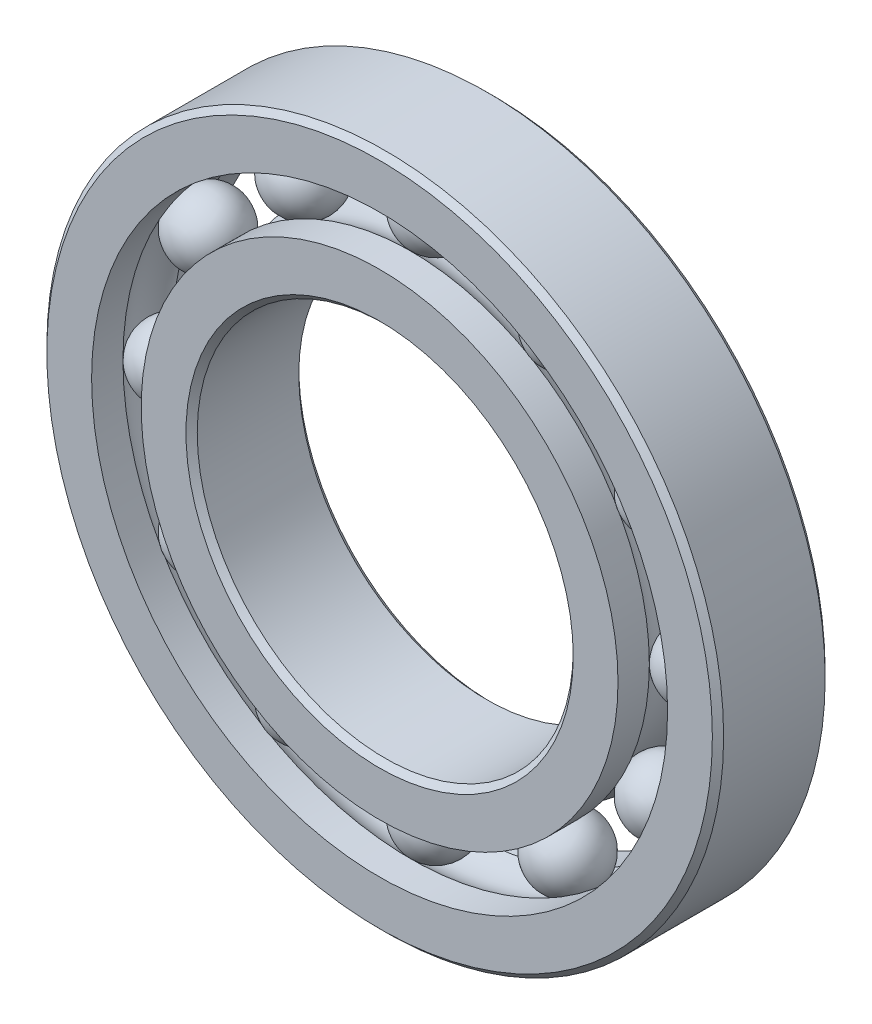
from build123d import *

# Parameters (mm, degrees)
CIRPATTERN1_COUNT = 12


with BuildPart() as part:
    # Sketch1 → Revolve1 (revolve)
    with BuildSketch(Plane(origin=(0, 0, 0), x_dir=(0, 0, -1), z_dir=(1, 0, 0))):
        with BuildLine():
            Line((4.28625, 28.575), (-4.28625, 28.575))
            Line((-4.28625, 28.575), (-4.7625, 28.09875))
            Line((-4.7625, 28.09875), (-4.7625, 24.318406593))
            Line((-4.7625, 24.318406593), (-2.116666667, 24.318406593))
            ThreePointArc((-2.116666667, 24.318406593), (0, 25.202016786), (2.116666667, 24.318406593))
            Line((2.116666667, 24.318406593), (4.7625, 24.318406593))
            Line((4.7625, 24.318406593), (4.7625, 28.09875))
            Line((4.7625, 28.09875), (4.28625, 28.575))
        make_face()
    revolve(axis=Axis((0, 0, 4.7625), (0, 0, -1)))


with BuildPart() as body_2:
    # Sketch3 → Revolve3 (revolve)
    with BuildSketch(Plane(origin=(0, 0, 0), x_dir=(0, 0, -1), z_dir=(1, 0, 0))):
        with BuildLine():
            Line((-4.7625, 20.131593407), (-2.116666667, 20.131593407))
            ThreePointArc((-2.116666667, 20.131593407), (0, 19.247983214), (2.116666667, 20.131593407))
            Line((2.116666667, 20.131593407), (4.7625, 20.131593407))
            Line((4.7625, 20.131593407), (4.7625, 16.35125))
            Line((4.7625, 16.35125), (4.28625, 15.875))
            Line((4.28625, 15.875), (-4.28625, 15.875))
            Line((-4.28625, 15.875), (-4.7625, 16.35125))
            Line((-4.7625, 16.35125), (-4.7625, 20.131593407))
        make_face()
    revolve(axis=Axis((0, 0, 4.7625), (0, 0, -1)))


with BuildPart() as body_3:
    # Sketch4 → Revolve4 (revolve)
    with BuildSketch(Plane(origin=(0, 0, 0), x_dir=(0, 0, -1), z_dir=(1, 0, 0))):
        with BuildLine():
            Line((-2.977016786, 22.225), (2.977016786, 22.225))
            ThreePointArc((2.977016786, 22.225), (0, 25.202016786), (-2.977016786, 22.225))
        make_face()
    revolve(axis=Axis((0, 22.225, 2.977016786), (0, 0, -1)))


with BuildPart() as cirpattern1_1:
    # CirPattern1: pattern copy
    add(body_3.part.rotate(Axis((0, 0, -4.7625), (0, 0, 1)), 1 * 360 / CIRPATTERN1_COUNT))


with BuildPart() as cirpattern1_2:
    # CirPattern1: pattern copy
    add(body_3.part.rotate(Axis((0, 0, -4.7625), (0, 0, 1)), 2 * 360 / CIRPATTERN1_COUNT))


with BuildPart() as cirpattern1_3:
    # CirPattern1: pattern copy
    add(body_3.part.rotate(Axis((0, 0, -4.7625), (0, 0, 1)), 3 * 360 / CIRPATTERN1_COUNT))


with BuildPart() as cirpattern1_4:
    # CirPattern1: pattern copy
    add(body_3.part.rotate(Axis((0, 0, -4.7625), (0, 0, 1)), 4 * 360 / CIRPATTERN1_COUNT))


with BuildPart() as cirpattern1_5:
    # CirPattern1: pattern copy
    add(body_3.part.rotate(Axis((0, 0, -4.7625), (0, 0, 1)), 5 * 360 / CIRPATTERN1_COUNT))


with BuildPart() as cirpattern1_6:
    # CirPattern1: pattern copy
    add(body_3.part.rotate(Axis((0, 0, -4.7625), (0, 0, 1)), 6 * 360 / CIRPATTERN1_COUNT))


with BuildPart() as cirpattern1_7:
    # CirPattern1: pattern copy
    add(body_3.part.rotate(Axis((0, 0, -4.7625), (0, 0, 1)), 7 * 360 / CIRPATTERN1_COUNT))


with BuildPart() as cirpattern1_8:
    # CirPattern1: pattern copy
    add(body_3.part.rotate(Axis((0, 0, -4.7625), (0, 0, 1)), 8 * 360 / CIRPATTERN1_COUNT))


with BuildPart() as cirpattern1_9:
    # CirPattern1: pattern copy
    add(body_3.part.rotate(Axis((0, 0, -4.7625), (0, 0, 1)), 9 * 360 / CIRPATTERN1_COUNT))


with BuildPart() as cirpattern1_10:
    # CirPattern1: pattern copy
    add(body_3.part.rotate(Axis((0, 0, -4.7625), (0, 0, 1)), 10 * 360 / CIRPATTERN1_COUNT))


with BuildPart() as cirpattern1_11:
    # CirPattern1: pattern copy
    add(body_3.part.rotate(Axis((0, 0, -4.7625), (0, 0, 1)), 11 * 360 / CIRPATTERN1_COUNT))


solid = Compound([part.part, body_2.part, body_3.part, cirpattern1_1.part, cirpattern1_2.part, cirpattern1_3.part, cirpattern1_4.part, cirpattern1_5.part, cirpattern1_6.part, cirpattern1_7.part, cirpattern1_8.part, cirpattern1_9.part, cirpattern1_10.part, cirpattern1_11.part])
